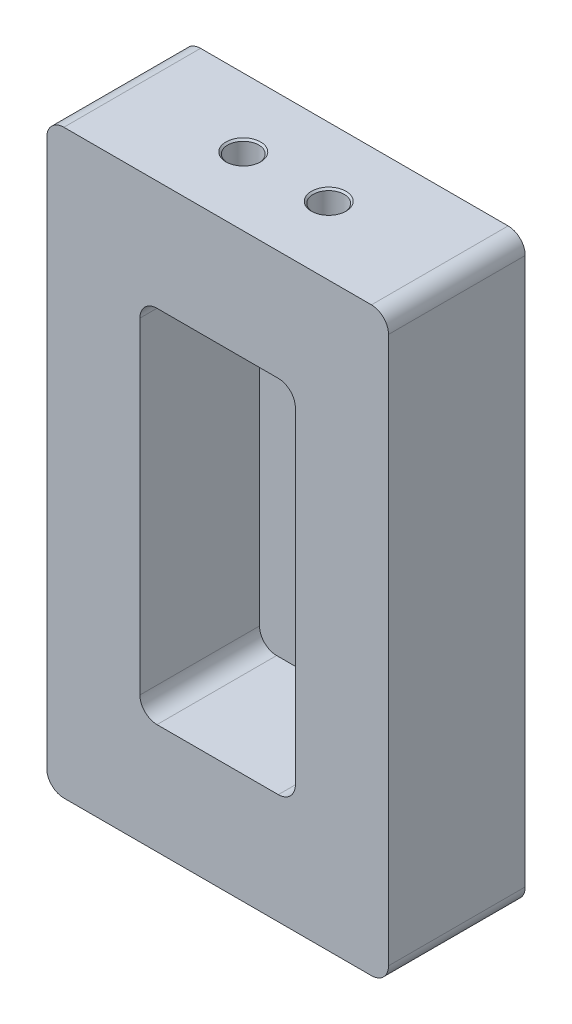
from build123d import *

# Parameters (mm, degrees)
SKETCH1_W                              = 100
SKETCH1_H                              = 170
BOSS_EXTRUDE1_DEPTH                    = 40
F_1_8_27_NPSM_TAPPED_HOLE1_D           = 9.0932
F_1_8_27_NPSM_TAPPED_HOLE1_DEPTH       = 22.987
F_1_8_27_NPSM_TAPPED_HOLE1_CSINK_D     = 10.1338
F_1_8_27_NPSM_TAPPED_HOLE1_CSINK_ANGLE = 90
F_1_8_27_NPSM_TAPPED_HOLE1_TIP         = 2.73187289
SKETCH11_W                             = 45.5
SKETCH11_H                             = 105.5
CUT_EXTRUDE3_DEPTH                     = 35
CUT_EXTRUDE4_DEPTH                     = 35
SKETCH13_W                             = 22.5
SKETCH13_H                             = 15
CUT_EXTRUDE5_DEPTH                     = 35
FILLET1_R                              = 5
FILLET2_R                              = 5
M3X0_5_TAPPED_HOLE1_D                  = 2.5
M3X0_5_TAPPED_HOLE1_DEPTH              = 7.5
M3X0_5_TAPPED_HOLE1_CSINK_D            = 3.05
M3X0_5_TAPPED_HOLE1_CSINK_ANGLE        = 90
M3X0_5_TAPPED_HOLE1_TIP                = 0.751075774
FILLET3_R                              = 5


with BuildPart() as part:
    # Sketch1 → Boss-Extrude1 (new body)
    with BuildSketch(Plane.XY):
        with Locations((50, 85)):
            Rectangle(SKETCH1_W, SKETCH1_H)
    extrude(amount=BOSS_EXTRUDE1_DEPTH)

    # 1/8-27 NPSM Tapped Hole1
    with Locations(Plane(origin=(0, 170, 0), x_dir=(1, 0, 0), z_dir=(0, 1, 0))):
        with Locations((37.5, -20), (62.5, -20)):
            CounterSinkHole(F_1_8_27_NPSM_TAPPED_HOLE1_D / 2, F_1_8_27_NPSM_TAPPED_HOLE1_CSINK_D / 2, depth=F_1_8_27_NPSM_TAPPED_HOLE1_DEPTH, counter_sink_angle=F_1_8_27_NPSM_TAPPED_HOLE1_CSINK_ANGLE)
            with Locations((0, 0, -(F_1_8_27_NPSM_TAPPED_HOLE1_DEPTH + F_1_8_27_NPSM_TAPPED_HOLE1_TIP / 2))):  # 118° drill point
                Cone(0, F_1_8_27_NPSM_TAPPED_HOLE1_D / 2, F_1_8_27_NPSM_TAPPED_HOLE1_TIP, mode=Mode.SUBTRACT)

    # Sketch11 → Cut-Extrude3 (cut)
    with BuildSketch(Plane.XY.offset(40)):
        with Locations((50, 85)):
            Rectangle(SKETCH11_W, SKETCH11_H)
    extrude(amount=-CUT_EXTRUDE3_DEPTH, mode=Mode.SUBTRACT)

    # Sketch12 → Cut-Extrude4 (cut)
    with BuildSketch(Plane(origin=(0, 0, 0), x_dir=(-1, 0, 0), z_dir=(0, 0, -1))):
        Polygon((-90, 160), (-75, 160), (-75, 25), (-25, 25), (-25, 160), (-10, 160), (-10, 10), (-25, 10), (-75, 10), (-90, 10), align=None)
    extrude(amount=-CUT_EXTRUDE4_DEPTH, mode=Mode.SUBTRACT)

    # Sketch13 → Cut-Extrude5 (cut)
    with BuildSketch(Plane(origin=(0, 0, 0), x_dir=(-1, 0, 0), z_dir=(0, 0, -1))):
        with Locations((-63.75, 152.5)):
            Rectangle(SKETCH13_W, SKETCH13_H)
        with Locations((-36.25, 152.5)):
            Rectangle(SKETCH13_W, SKETCH13_H)
    extrude(amount=-CUT_EXTRUDE5_DEPTH, mode=Mode.SUBTRACT)

    # Fillet1
    fillet1_edges = [part.edges().sort_by_distance(p)[0] for p in [
        (90, 10, 17.5),
        (90, 160, 17.5),
        (75, 25, 17.5),
        (25, 25, 17.5),
        (10, 160, 17.5),
        (10, 10, 17.5),
        (52.5, 145, 17.5),
        (75, 145, 17.5),
        (52.5, 160, 17.5),
        (25, 145, 17.5),
        (47.5, 160, 17.5),
        (47.5, 145, 17.5),
    ]]
    fillet(fillet1_edges, radius=FILLET1_R)

    # Fillet2
    fillet2_edges = [part.edges().sort_by_distance(p)[0] for p in [
        (27.25, 32.25, 22.5),
        (27.25, 137.75, 22.5),
        (72.75, 137.75, 22.5),
        (72.75, 32.25, 22.5),
    ]]
    fillet(fillet2_edges, radius=FILLET2_R)

    # M3x0.5 Tapped Hole1
    with Locations(Plane(origin=(0, 0, 0), x_dir=(-1, 0, 0), z_dir=(0, 0, -1))):
        with Locations((-95, 165), (-50, 165), (-5, 165), (-5, 85), (-5, 5), (-50, 5), (-95, 5), (-95, 85)):
            CounterSinkHole(M3X0_5_TAPPED_HOLE1_D / 2, M3X0_5_TAPPED_HOLE1_CSINK_D / 2, depth=M3X0_5_TAPPED_HOLE1_DEPTH, counter_sink_angle=M3X0_5_TAPPED_HOLE1_CSINK_ANGLE)
            with Locations((0, 0, -(M3X0_5_TAPPED_HOLE1_DEPTH + M3X0_5_TAPPED_HOLE1_TIP / 2))):  # 118° drill point
                Cone(0, M3X0_5_TAPPED_HOLE1_D / 2, M3X0_5_TAPPED_HOLE1_TIP, mode=Mode.SUBTRACT)

    # Fillet3
    fillet3_edges = [part.edges().sort_by_distance(p)[0] for p in [
        (0, 170, 20),
        (100, 170, 20),
        (100, 0, 20),
        (0, 0, 20),
    ]]
    fillet(fillet3_edges, radius=FILLET3_R)


solid = part.part
